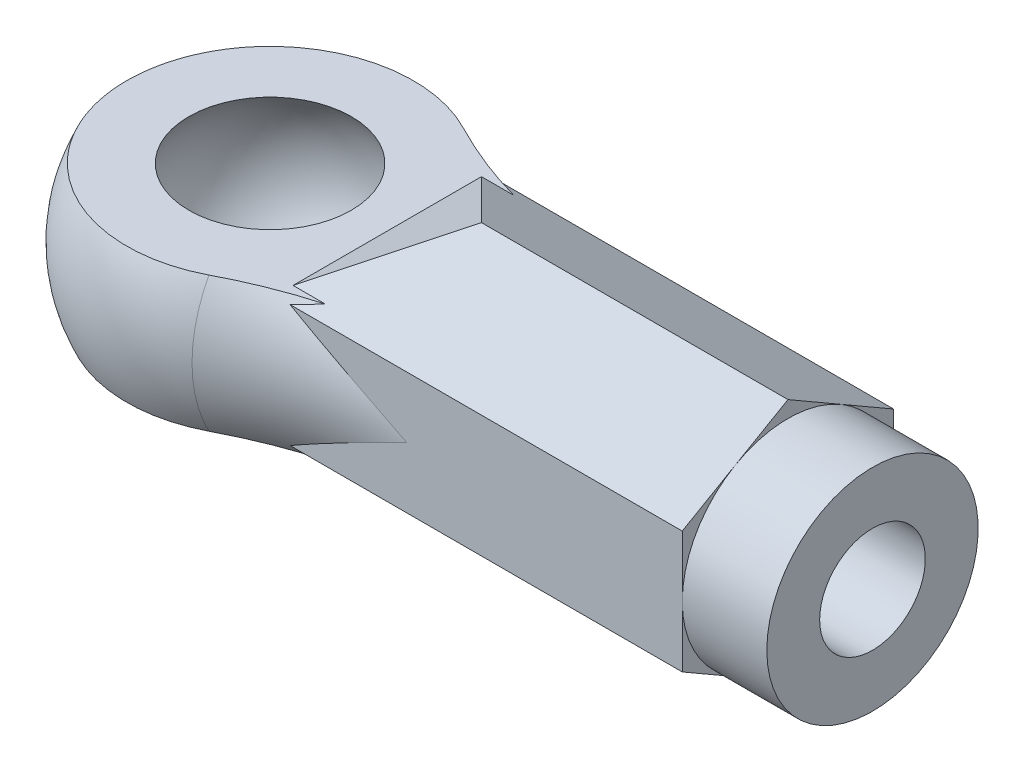
from build123d import *

# Parameters (mm, degrees)
ESQUISSE3_W             = 9.75
ESQUISSE3_H             = 2.4
ENL_V_MAT_EXTRU_1_DEPTH = 5
BOSS_EXTRU_1_START      = -12
ESQUISSE2_R             = 1.25
BOSS_EXTRU_1_DEPTH      = 10
ENL_V_MAT_EXTRU_2_DEPTH = 5


with BuildPart() as part:
    # Esquisse1 → Révolution1 (revolve)
    with BuildSketch(Plane.XY, mode=Mode.PRIVATE) as r_volution1_sk:
        with BuildLine():
            Line((-2.5, 0), (-3.75, 0))
            ThreePointArc((-3.75, 0), (-2.025351028, 3.15601857), (1.562241714, 3.409090909))
            ThreePointArc((1.562241714, 3.409090909), (3.596212455, 2.729915791), (5.728219619, 2.5))
            Line((5.728219619, 2.5), (14.25, 2.5))
            Line((14.25, 2.5), (14.25, 1.25))
            Line((14.25, 1.25), (4.5, 1.25))
            Line((4.5, 1.25), (4.5, 0))
            Line((4.5, 0), (2.5, 0))
            ThreePointArc((2.5, 0), (0, 2.5), (-2.5, 0))
        make_face()
    revolve(r_volution1_sk.sketch.rotate(Axis((4.5, 0, 0), (1, 0, 0)), 90), axis=Axis((4.5, 0, 0), (1, 0, 0)))

    # Esquisse3 → Enlèv. mat.-Extru.1 (cut, symmetric)
    with BuildSketch(Plane.XY):
        with Locations((1.125, 2.8)):
            Rectangle(ESQUISSE3_W, ESQUISSE3_H)
        with Locations((1.125, -2.8)):
            Rectangle(ESQUISSE3_W, ESQUISSE3_H)
    extrude(amount=ENL_V_MAT_EXTRU_1_DEPTH, both=True, mode=Mode.SUBTRACT)

    # Esquisse2 → Boss.-Extru.1 (add)
    with BuildSketch(Plane(origin=(14.25, 0, 0), x_dir=(0, 0, -1), z_dir=(1, 0, 0)).offset(BOSS_EXTRU_1_START)):
        Polygon((0, 2.886751346), (-2.5, 1.443375673), (-2.5, -1.443375673), (0, -2.886751346), (2.5, -1.443375673), (2.5, 1.443375673), align=None)
        with Locations(Location((0, 0, 0), (0, 0, 180))):
            Circle(ESQUISSE2_R, mode=Mode.SUBTRACT)
    extrude(amount=BOSS_EXTRU_1_DEPTH)

    # Esquisse4 → Enlèv. mat.-Extru.2 (cut, symmetric)
    with BuildSketch(Plane.XY):
        Polygon((2.771281292, 1.6), (5, 2.886751346), (-3.75, 2.886751346), (-3.75, 1.6), align=None)
        Polygon((-3.75, -1.6), (2.771281292, -1.6), (5, -2.886751346), (-3.75, -2.886751346), align=None)
    extrude(amount=ENL_V_MAT_EXTRU_2_DEPTH, both=True, mode=Mode.SUBTRACT)


solid = part.part
